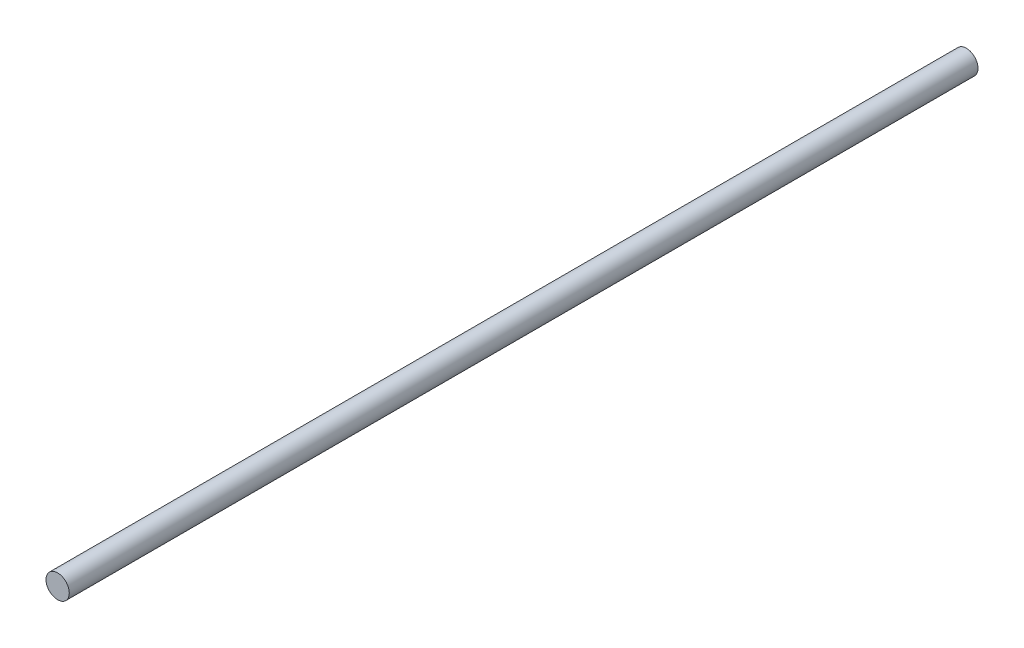
from build123d import *

# Parameters (mm, degrees)
SKIZZE1_R                       = 2.5
AUFSATZ_LINEAR_AUSTRAGEN1_DEPTH = 195


with BuildPart() as part:
    # Skizze1 → Aufsatz-Linear austragen1 (new body)
    with BuildSketch(Plane.XY):
        with Locations((-21.202438913, 3.95852329)):
            Circle(SKIZZE1_R)
    extrude(amount=AUFSATZ_LINEAR_AUSTRAGEN1_DEPTH)


solid = part.part
